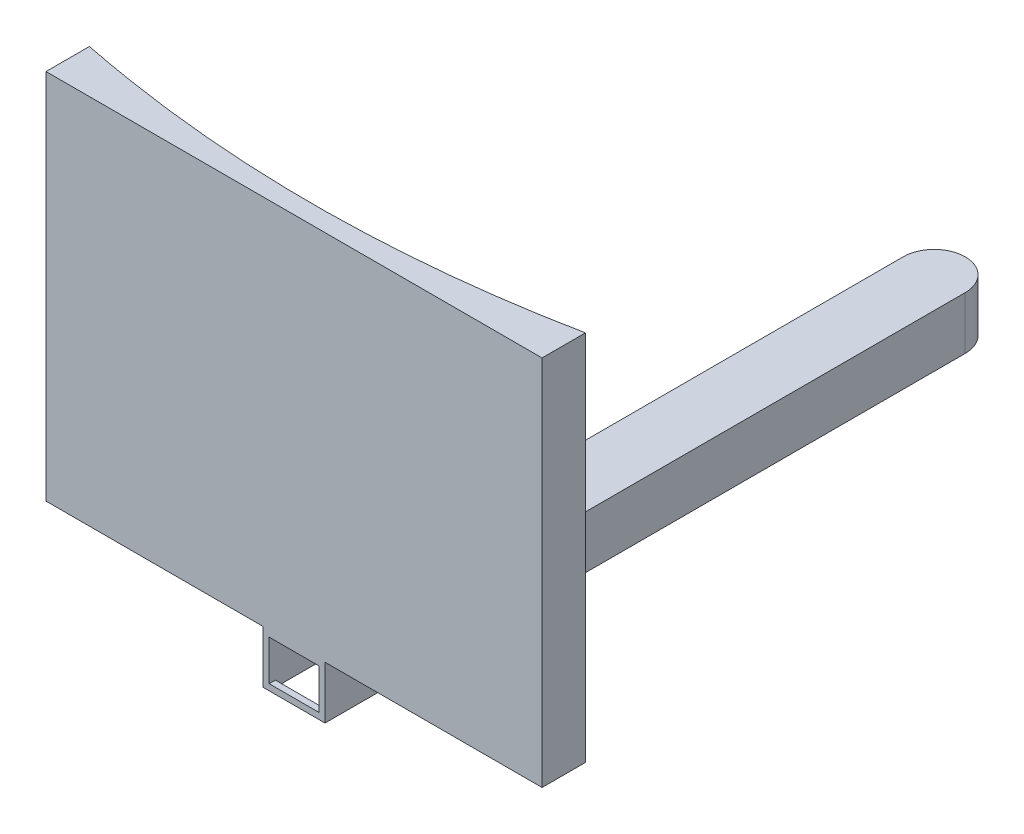
from build123d import *

# Parameters (mm, degrees)
BOSS_EXTRUDE3_DEPTH = 120
BOSS_EXTRUDE4_DEPTH = 2
BOSS_EXTRUDE5_DEPTH = 15
SKETCH8_W           = 16
SKETCH8_H           = 13
CUT_EXTRUDE2_DEPTH  = 15


with BuildPart() as part:
    # Sketch4 → Boss-Extrude3 (new body)
    with BuildSketch(Plane(origin=(0, 0, 0), x_dir=(1, 0, 0), z_dir=(0, 1, 0))):
        with BuildLine():
            Line((-80, -192.509889923), (-80, -206.5))
            Line((-80, -206.5), (80, -206.5))
            Line((80, -206.5), (80, -192.509889923))
            add(Edge.make_bspline(
                [(-80, -192.509889923), (-72.106688699, -194.086619514), (-45.4407372, -198.624917909), (0, -201.8200332), (45.4407372, -198.624917909), (72.106688699, -194.086619514), (80, -192.509889923)],
                knots=[0.498587518, 0.498587518, 0.498587518, 0.498587518, 0.499005631, 0.5, 0.500994369, 0.501412482, 0.501412482, 0.501412482, 0.501412482], degree=3))
        make_face()
    extrude(amount=BOSS_EXTRUDE3_DEPTH)

    # Sketch6 → Boss-Extrude4 (add)
    with BuildSketch(Plane.XZ):
        with BuildLine():
            Line((10, 0), (10, 206.5))
            Line((10, 206.5), (-10, 206.5))
            Line((-10, 206.5), (-10, 0))
            ThreePointArc((-10, 0), (0, -10), (10, 0))
        make_face()
    extrude(amount=BOSS_EXTRUDE4_DEPTH)

    # Sketch7 → Boss-Extrude5 (add)
    with BuildSketch(Plane.XZ.offset(2)):
        with BuildLine():
            Line((10, 0), (10, 206.5))
            Line((10, 206.5), (-10, 206.5))
            Line((-10, 206.5), (-10, 0))
            ThreePointArc((-10, 0), (0, -10), (10, 0))
        make_face()
        with BuildLine():
            Line((8, 0), (8, 204.5))
            Line((8, 204.5), (-8, 204.5))
            Line((-8, 204.5), (-8, 0))
            ThreePointArc((-8, 0), (0, -8), (8, 0))
        make_face(mode=Mode.SUBTRACT)
    extrude(amount=BOSS_EXTRUDE5_DEPTH)

    # Sketch8 → Cut-Extrude2 (cut)
    with BuildSketch(Plane.XY.offset(206.5)):
        with Locations((0, -8.5)):
            Rectangle(SKETCH8_W, SKETCH8_H)
    extrude(amount=-CUT_EXTRUDE2_DEPTH, mode=Mode.SUBTRACT)


solid = part.part
